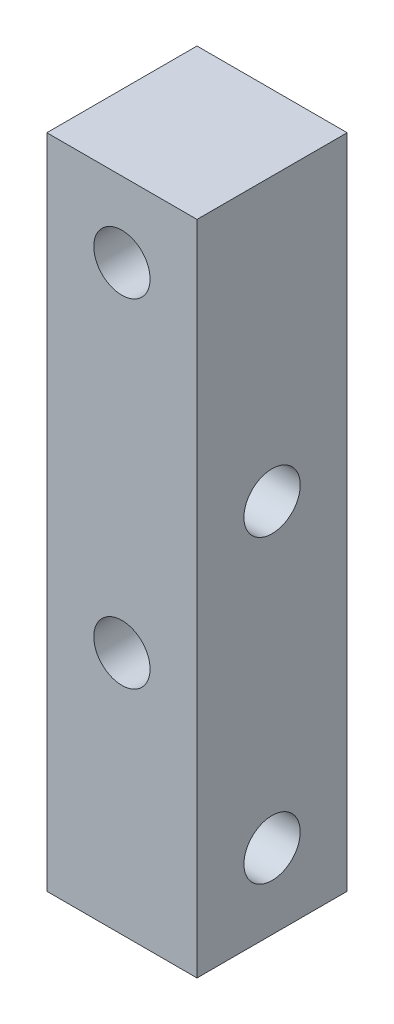
from build123d import *

# Parameters (mm, degrees)
SKETCH1_W           = 8
SKETCH1_H           = 8
BOSS_EXTRUDE1_DEPTH = 35
SKETCH2_R           = 1.5
CUT_EXTRUDE1_DEPTH  = 37.124783736
SKETCH3_R           = 1.5
CUT_EXTRUDE2_DEPTH  = 37.124783736


with BuildPart() as part:
    # Sketch1 → Boss-Extrude1 (new body)
    with BuildSketch(Plane(origin=(0, 0, 0), x_dir=(1, 0, 0), z_dir=(0, 1, 0))):
        Rectangle(SKETCH1_W, SKETCH1_H)
    extrude(amount=BOSS_EXTRUDE1_DEPTH)

    # Sketch2 → Cut-Extrude1 (cut, through all)
    with BuildSketch(Plane(origin=(0, 0, -4), x_dir=(-1, 0, 0), z_dir=(0, 0, -1))):
        with Locations((0, 31)):
            Circle(SKETCH2_R)
        with Locations((0, 13)):
            Circle(SKETCH2_R)
    extrude(amount=-CUT_EXTRUDE1_DEPTH, mode=Mode.SUBTRACT)

    # Sketch3 → Cut-Extrude2 (cut, through all)
    with BuildSketch(Plane(origin=(4, 0, 0), x_dir=(0, 0, -1), z_dir=(1, 0, 0))):
        with Locations((0, 20)):
            Circle(SKETCH3_R)
        with Locations((0, 4)):
            Circle(SKETCH3_R)
    extrude(amount=-CUT_EXTRUDE2_DEPTH, mode=Mode.SUBTRACT)


solid = part.part
